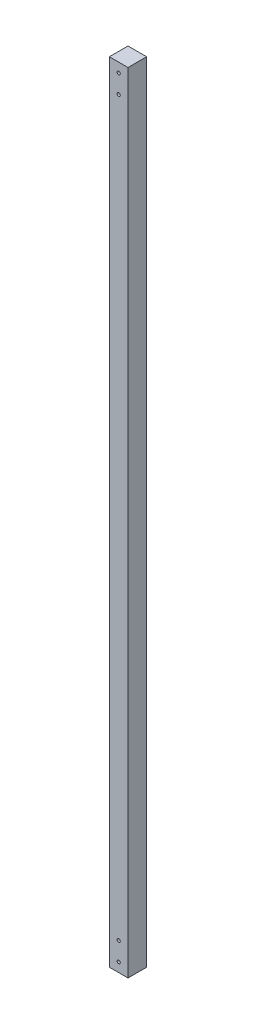
from build123d import *

# Parameters (mm, degrees)
SKETCH_1_W          = 20
SKETCH_1_H          = 20
EXTRUDE_1_DEPTH     = 846.5
SKETCH_2_R          = 1.7
CUT_EXTRUDE_1_DEPTH = 847.972402148


with BuildPart() as part:
    # 草图1 → 凸台-拉伸1 (new body)
    with BuildSketch(Plane(origin=(0, 0, 0), x_dir=(1, 0, 0), z_dir=(0, 1, 0))):
        with Locations((10, 10)):
            Rectangle(SKETCH_1_W, SKETCH_1_H)
    extrude(amount=EXTRUDE_1_DEPTH)

    # 草图2 → 切除-拉伸1 (cut, through all)
    with BuildSketch(Plane.XY):
        with Locations((10, 10)):
            Circle(SKETCH_2_R)
        with Locations((10, 30)):
            Circle(SKETCH_2_R)
        with Locations((10, 836.5)):
            Circle(SKETCH_2_R)
        with Locations((10, 816.5)):
            Circle(SKETCH_2_R)
    extrude(amount=-CUT_EXTRUDE_1_DEPTH, mode=Mode.SUBTRACT)


solid = part.part
